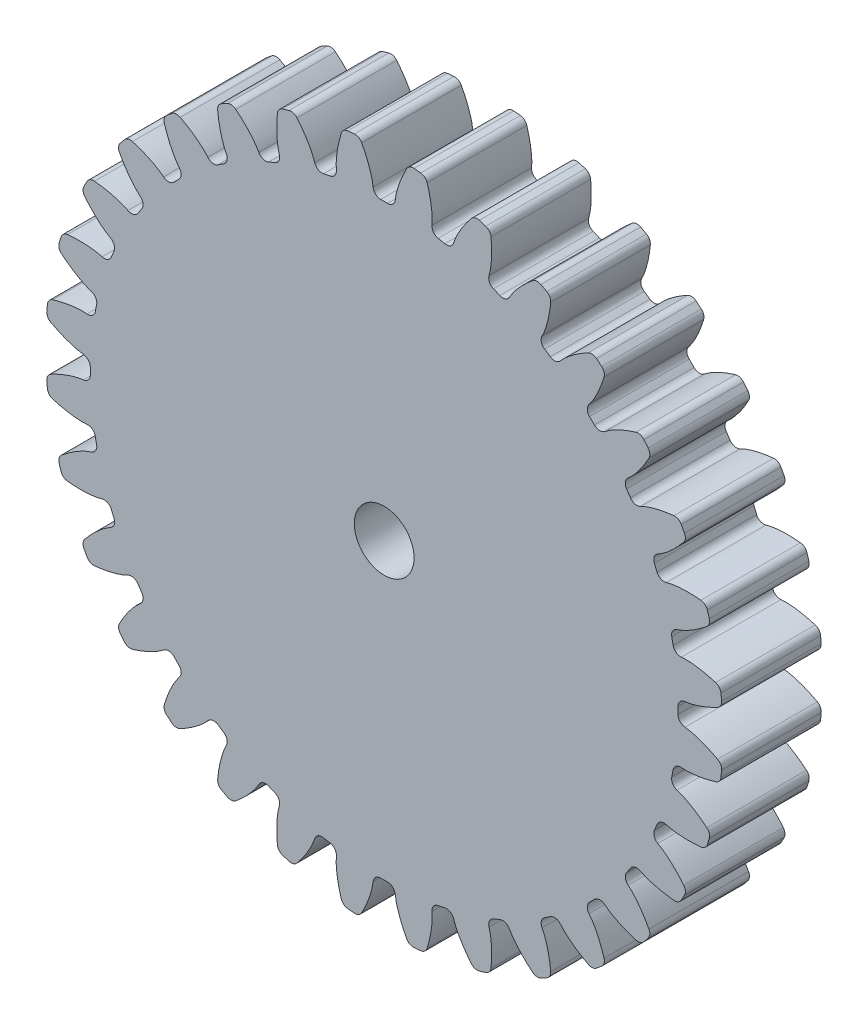
from build123d import *

# Parameters (mm, degrees)
SKETCH_1_R                       = 17
SKETCH_1_R_2                     = 1.5
EXTRUDE_1_DEPTH                  = 5
CUT_EXTRUDE_1_DEPTH              = 25.556058316
FILLET_1_R                       = 0.38
PATTERN_CIRCULAR_1_COUNT         = 32
PATTERN_CIRCULAR_1_ANGLE         = 348.75
FILLET_1_OF_PATTERN_CIRCULAR_1_R = 0.38


with BuildPart() as part:
    # 草图1 → 凸台-拉伸1 (new body)
    with BuildSketch(Plane.XY):
        Circle(SKETCH_1_R)
        Circle(SKETCH_1_R_2, mode=Mode.SUBTRACT)
    extrude(amount=EXTRUDE_1_DEPTH)

    # 草图1<3> → 切除-拉伸1 (cut, through all)
    with BuildSketch(Plane.XY):
        with BuildLine():
            Line((15.024989491, 0.550798969), (14.740098923, 0.540355206))
            ThreePointArc((14.740098923, 0.540355206), (14.747524523, 0.270222954), (14.75, 0))
            ThreePointArc((14.75, 0), (14.747524523, -0.270222954), (14.740098923, -0.540355206))
            Line((14.740098923, -0.540355206), (15.024989491, -0.550798969))
            add(Edge.make_bspline(
                [(15.024989491, -0.550798969), (15.053576926, -0.551846951), (15.110609247, -0.55569715), (15.224103282, -0.570306373), (15.437834474, -0.611548753), (15.720031974, -0.688279191), (16.153691453, -0.84274904), (16.51944105, -1.012508524), (16.78382383, -1.153572651), (16.953859177, -1.251662498)],
                knots=[0, 0, 0, 0, 0, 0.001401017, 0.002802034, 0.005604068, 0.010661158, 0.015718248, 0.025338633, 0.025338633, 0.025338633, 0.025338633, 0.025338633], degree=4))
            ThreePointArc((16.953859177, -1.251662498), (16.988460878, -0.626256334), (17, 0))
            ThreePointArc((17, 0), (16.988460878, 0.626256334), (16.953859177, 1.251662498))
            add(Edge.make_bspline(
                [(15.024989491, 0.550798969), (15.053576926, 0.551846951), (15.110609247, 0.55569715), (15.224103282, 0.570306373), (15.437834474, 0.611548753), (15.720031974, 0.688279191), (16.153691453, 0.84274904), (16.51944105, 1.012508524), (16.78382383, 1.153572651), (16.953859177, 1.251662498)],
                knots=[0, 0, 0, 0, 0, 0.001401017, 0.002802034, 0.005604068, 0.010661158, 0.015718248, 0.025338633, 0.025338633, 0.025338633, 0.025338633, 0.025338633], degree=4))
        make_face()
    cut_extrude_1 = extrude(amount=CUT_EXTRUDE_1_DEPTH, mode=Mode.SUBTRACT)

    # 圆角1
    fillet_1_edges = [part.edges().sort_by_distance(p)[0] for p in [
        (16.953859177, 1.251662498, 2.5),
        (16.953859177, -1.251662498, 2.5),
        (14.740098923, 0.540355206, 2.5),
        (14.740098923, -0.540355206, 2.5),
    ]]
    fillet(fillet_1_edges, radius=FILLET_1_R)

    # 阵列(圆周)1: 切除-拉伸1 ×32 about axis
    pattern_circular_1_axis = Axis((0, 0, 5), (0, 0, 1))
    for i in range(1, PATTERN_CIRCULAR_1_COUNT):
        add(cut_extrude_1.rotate(pattern_circular_1_axis, i * PATTERN_CIRCULAR_1_ANGLE / (PATTERN_CIRCULAR_1_COUNT - 1)), mode=Mode.SUBTRACT)

    # 圆角1 of 阵列(圆周)1
    fillet_1_of_pattern_circular_1_edges = [part.edges().sort_by_distance(p)[0] for p in [
        (16.383908287, 4.535146, 2.5),
        (16.872282767, 2.079921692, 2.5),
        (14.351453984, 3.405623077, 2.5),
        (14.562290126, 2.345678214, 2.5),
        (15.18433299, 7.644346385, 2.5),
        (16.142313992, 5.331575658, 2.5),
        (13.411290717, 6.140014764, 2.5),
        (13.824860687, 5.141568534, 2.5),
        (13.401232291, 10.459778825, 2.5),
        (14.792005143, 8.378340162, 2.5),
        (11.955739069, 8.638449126, 2.5),
        (12.556149604, 7.73987126, 2.5),
        (11.103129751, 12.873247831, 2.5),
        (12.873247831, 11.103129751, 2.5),
        (10.040735074, 10.804912734, 2.5),
        (10.804912734, 10.040735074, 2.5),
        (8.378340162, 14.792005143, 2.5),
        (10.459778825, 13.401232291, 2.5),
        (7.73987126, 12.556149604, 2.5),
        (8.638449126, 11.955739069, 2.5),
        (5.331575658, 16.142313992, 2.5),
        (7.644346385, 15.18433299, 2.5),
        (5.141568534, 13.824860687, 2.5),
        (6.140014764, 13.411290717, 2.5),
        (2.079921692, 16.872282767, 2.5),
        (4.535146, 16.383908287, 2.5),
        (2.345678214, 14.562290126, 2.5),
        (3.405623077, 14.351453984, 2.5),
        (-1.251662498, 16.953859177, 2.5),
        (1.251662498, 16.953859177, 2.5),
        (-0.540355206, 14.740098923, 2.5),
        (0.540355206, 14.740098923, 2.5),
        (-4.535146, 16.383908287, 2.5),
        (-2.079921692, 16.872282767, 2.5),
        (-3.405623077, 14.351453984, 2.5),
        (-2.345678214, 14.562290126, 2.5),
        (-7.644346385, 15.18433299, 2.5),
        (-5.331575658, 16.142313992, 2.5),
        (-6.140014764, 13.411290717, 2.5),
        (-5.141568534, 13.824860687, 2.5),
        (-10.459778825, 13.401232291, 2.5),
        (-8.378340162, 14.792005143, 2.5),
        (-8.638449126, 11.955739069, 2.5),
        (-7.73987126, 12.556149604, 2.5),
        (-12.873247831, 11.103129751, 2.5),
        (-11.103129751, 12.873247831, 2.5),
        (-10.804912734, 10.040735074, 2.5),
        (-10.040735074, 10.804912734, 2.5),
        (-14.792005143, 8.378340162, 2.5),
        (-13.401232291, 10.459778825, 2.5),
        (-12.556149604, 7.73987126, 2.5),
        (-11.955739069, 8.638449126, 2.5),
        (-16.142313992, 5.331575658, 2.5),
        (-15.18433299, 7.644346385, 2.5),
        (-13.824860687, 5.141568534, 2.5),
        (-13.411290717, 6.140014764, 2.5),
        (-16.872282767, 2.079921692, 2.5),
        (-16.383908287, 4.535146, 2.5),
        (-14.562290126, 2.345678214, 2.5),
        (-14.351453984, 3.405623077, 2.5),
        (-16.953859177, -1.251662498, 2.5),
        (-16.953859177, 1.251662498, 2.5),
        (-14.740098923, -0.540355206, 2.5),
        (-14.740098923, 0.540355206, 2.5),
        (-16.383908287, -4.535146, 2.5),
        (-16.872282767, -2.079921692, 2.5),
        (-14.351453984, -3.405623077, 2.5),
        (-14.562290126, -2.345678214, 2.5),
        (-15.18433299, -7.644346385, 2.5),
        (-16.142313992, -5.331575658, 2.5),
        (-13.411290717, -6.140014764, 2.5),
        (-13.824860687, -5.141568534, 2.5),
        (-13.401232291, -10.459778825, 2.5),
        (-14.792005143, -8.378340162, 2.5),
        (-11.955739069, -8.638449126, 2.5),
        (-12.556149604, -7.73987126, 2.5),
        (-11.103129751, -12.873247831, 2.5),
        (-12.873247831, -11.103129751, 2.5),
        (-10.040735074, -10.804912734, 2.5),
        (-10.804912734, -10.040735074, 2.5),
        (-8.378340162, -14.792005143, 2.5),
        (-10.459778825, -13.401232291, 2.5),
        (-7.73987126, -12.556149604, 2.5),
        (-8.638449126, -11.955739069, 2.5),
        (-5.331575658, -16.142313992, 2.5),
        (-7.644346385, -15.18433299, 2.5),
        (-5.141568534, -13.824860687, 2.5),
        (-6.140014764, -13.411290717, 2.5),
        (-2.079921692, -16.872282767, 2.5),
        (-4.535146, -16.383908287, 2.5),
        (-2.345678214, -14.562290126, 2.5),
        (-3.405623077, -14.351453984, 2.5),
        (1.251662498, -16.953859177, 2.5),
        (-1.251662498, -16.953859177, 2.5),
        (0.540355206, -14.740098923, 2.5),
        (-0.540355206, -14.740098923, 2.5),
        (4.535146, -16.383908287, 2.5),
        (2.079921692, -16.872282767, 2.5),
        (3.405623077, -14.351453984, 2.5),
        (2.345678214, -14.562290126, 2.5),
        (7.644346385, -15.18433299, 2.5),
        (5.331575658, -16.142313992, 2.5),
        (6.140014764, -13.411290717, 2.5),
        (5.141568534, -13.824860687, 2.5),
        (10.459778825, -13.401232291, 2.5),
        (8.378340162, -14.792005143, 2.5),
        (8.638449126, -11.955739069, 2.5),
        (7.73987126, -12.556149604, 2.5),
        (12.873247831, -11.103129751, 2.5),
        (11.103129751, -12.873247831, 2.5),
        (10.804912734, -10.040735074, 2.5),
        (10.040735074, -10.804912734, 2.5),
        (14.792005143, -8.378340162, 2.5),
        (13.401232291, -10.459778825, 2.5),
        (12.556149604, -7.73987126, 2.5),
        (11.955739069, -8.638449126, 2.5),
        (16.142313992, -5.331575658, 2.5),
        (15.18433299, -7.644346385, 2.5),
        (13.824860687, -5.141568534, 2.5),
        (13.411290717, -6.140014764, 2.5),
        (16.872282767, -2.079921692, 2.5),
        (16.383908287, -4.535146, 2.5),
        (14.562290126, -2.345678214, 2.5),
        (14.351453984, -3.405623077, 2.5),
    ]]
    fillet(fillet_1_of_pattern_circular_1_edges, radius=FILLET_1_OF_PATTERN_CIRCULAR_1_R)


solid = part.part
